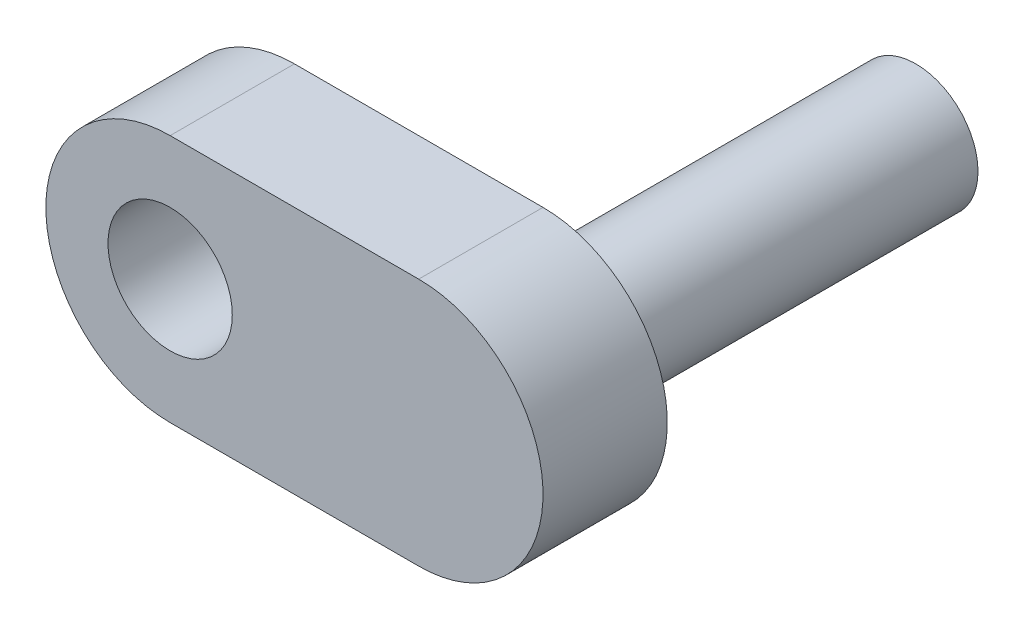
from build123d import *

# Parameters (mm, degrees)
SKETCH1_R           = 2.5
BOSS_EXTRUDE1_DEPTH = 5
SKETCH1_3_R         = 2.5
BOSS_EXTRUDE2_DEPTH = 15


with BuildPart() as part:
    # Sketch1 → Boss-Extrude1 (new body)
    with BuildSketch(Plane.XY):
        with BuildLine():
            Line((-13.904710079, 5), (-3.904710079, 5))
            ThreePointArc((-3.904710079, 5), (1.095289921, 0), (-3.904710079, -5))
            Line((-3.904710079, -5), (-13.904710079, -5))
            ThreePointArc((-13.904710079, -5), (-18.904710079, 0), (-13.904710079, 5))
        make_face()
        with Locations((-13.904710079, 0)):
            Circle(SKETCH1_R, mode=Mode.SUBTRACT)
    extrude(amount=BOSS_EXTRUDE1_DEPTH)

    # Sketch1<3> → Boss-Extrude2 (add)
    with BuildSketch(Plane.XY):
        with Locations((-3.904710079, 0)):
            Circle(SKETCH1_3_R)
    extrude(amount=-BOSS_EXTRUDE2_DEPTH)


solid = part.part
